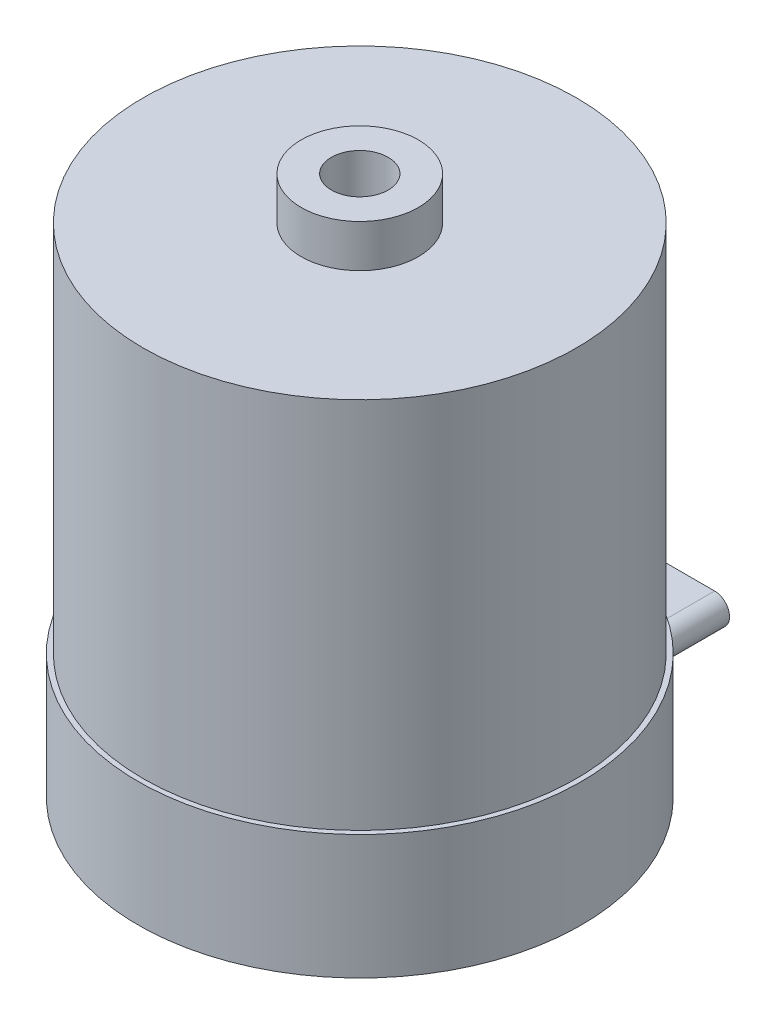
from build123d import *

# Parameters (mm, degrees)
SKETCH3_R           = 1.65
CUT_EXTRUDE1_DEPTH  = 5
BOSS_EXTRUDE1_START = -2
BOSS_EXTRUDE1_DEPTH = 15


with BuildPart() as part:
    # Sketch2 → Revolve1 (revolve)
    with BuildSketch(Plane.XY, mode=Mode.PRIVATE) as revolve1_sk:
        Polygon((4, 0), (4, 76), (8.25, 76), (8.25, 70), (30.5, 70), (30.5, 17.5), (31.2, 17.5), (31.2, 0), align=None)
    revolve(revolve1_sk.sketch.rotate(Axis((0, 0, 0), (0, 1, 0)), 90), axis=Axis((0, 0, 0), (0, 1, 0)))

    # Sketch3 → Cut-Extrude1 (cut)
    with BuildSketch(Plane.XZ):
        with Locations(Location((15.556349186, -15.556349186, 0), (0, 0, 270))):
            Circle(SKETCH3_R)
        with Locations(Location((-15.556349186, -15.556349186, 0), (0, 0, 270))):
            Circle(SKETCH3_R)
        with Locations(Location((-15.556349186, 15.556349186, 0), (0, 0, 270))):
            Circle(SKETCH3_R)
        with Locations(Location((15.556349186, 15.556349186, 0), (0, 0, 270))):
            Circle(SKETCH3_R)
    extrude(amount=-CUT_EXTRUDE1_DEPTH, mode=Mode.SUBTRACT)

    # Sketch4 → Boss-Extrude1 (add)
    with BuildSketch(Plane(origin=(0, 0, -31.2), x_dir=(-1, 0, 0), z_dir=(0, 0, -1)).offset(BOSS_EXTRUDE1_START)):
        with BuildLine():
            Line((-5.75, 5.9), (5.75, 5.9))
            ThreePointArc((5.75, 5.9), (7.85, 3.8), (5.75, 1.7))
            Line((5.75, 1.7), (-5.75, 1.7))
            ThreePointArc((-5.75, 1.7), (-7.85, 3.8), (-5.75, 5.9))
        make_face()
    extrude(amount=BOSS_EXTRUDE1_DEPTH)


solid = part.part
